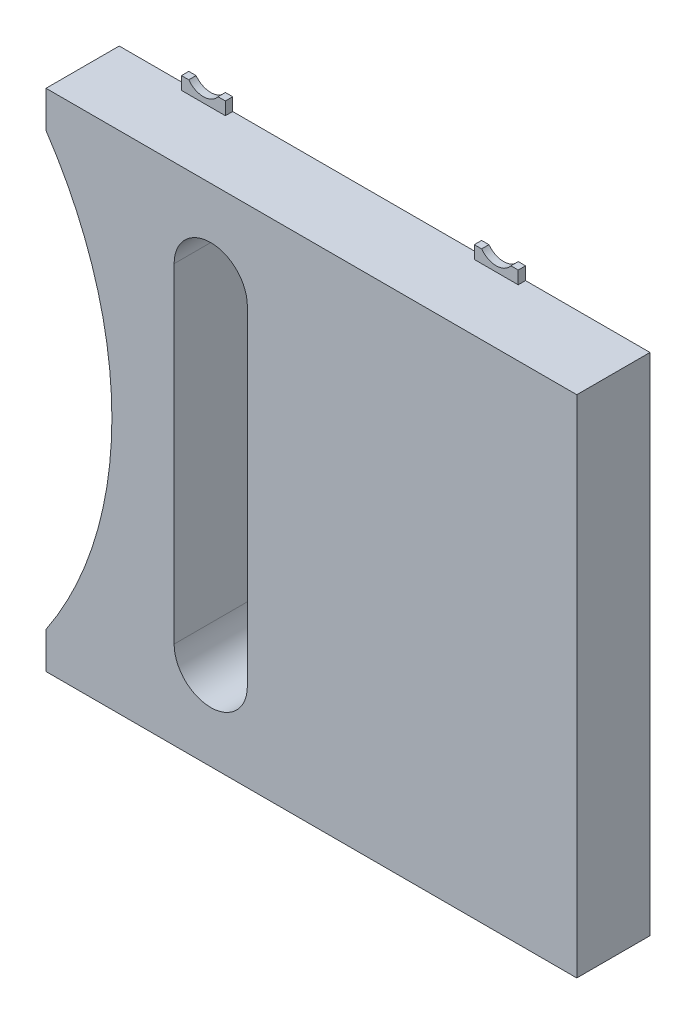
from build123d import *

# Parameters (mm, degrees)
BOSS_EXTRUDE1_DEPTH = 2
BOSS_EXTRUDE2_DEPTH = 0.2


with BuildPart() as part:
    # Sketch1 → Boss-Extrude1 (new body)
    with BuildSketch(Plane.XY):
        with BuildLine():
            Line((-7.25, 6.9), (-7.25, 5.9))
            ThreePointArc((-7.25, 5.9), (-5.45, 0), (-7.25, -5.9))
            Line((-7.25, -5.9), (-7.25, -6.9))
            Line((-7.25, -6.9), (7.25, -6.9))
            Line((7.25, -6.9), (7.25, 6.9))
            Line((7.25, 6.9), (-7.25, 6.9))
        make_face()
        with BuildLine():
            Line((-3.75, -4.5), (-3.75, 4.5))
            ThreePointArc((-3.75, 4.5), (-2.75, 5.5), (-1.75, 4.5))
            Line((-1.75, 4.5), (-1.75, -4.5))
            ThreePointArc((-1.75, -4.5), (-2.75, -5.5), (-3.75, -4.5))
        make_face(mode=Mode.SUBTRACT)
    extrude(amount=BOSS_EXTRUDE1_DEPTH)

    # Sketch2 → Boss-Extrude2 (add)
    with BuildSketch(Plane.XY):
        with BuildLine():
            Line((-5.15, 7.25), (-5.35, 7.25))
            Line((-5.35, 7.25), (-5.35, 6.9))
            Line((-5.35, 6.9), (-4.15, 6.9))
            Line((-4.15, 6.9), (-4.15, 7.25))
            Line((-4.15, 7.25), (-4.35, 7.25))
            ThreePointArc((-4.35, 7.25), (-4.75, 7.05), (-5.15, 7.25))
        make_face()
        with BuildLine():
            Line((2.65, 7.25), (2.85, 7.25))
            ThreePointArc((2.85, 7.25), (3.25, 7.05), (3.65, 7.25))
            Line((3.65, 7.25), (3.85, 7.25))
            Line((3.85, 7.25), (3.85, 6.9))
            Line((3.85, 6.9), (2.65, 6.9))
            Line((2.65, 6.9), (2.65, 7.25))
        make_face()
        with BuildLine():
            Line((3.65, -7.25), (3.85, -7.25))
            Line((3.85, -7.25), (3.85, -6.9))
            Line((3.85, -6.9), (2.65, -6.9))
            Line((2.65, -6.9), (2.65, -7.25))
            Line((2.65, -7.25), (2.85, -7.25))
            ThreePointArc((2.85, -7.25), (3.25, -7.05), (3.65, -7.25))
        make_face()
        with BuildLine():
            Line((-4.15, -7.25), (-4.35, -7.25))
            ThreePointArc((-4.35, -7.25), (-4.75, -7.05), (-5.15, -7.25))
            Line((-5.15, -7.25), (-5.35, -7.25))
            Line((-5.35, -7.25), (-5.35, -6.9))
            Line((-5.35, -6.9), (-4.15, -6.9))
            Line((-4.15, -6.9), (-4.15, -7.25))
        make_face()
    extrude(amount=BOSS_EXTRUDE2_DEPTH)


solid = part.part
